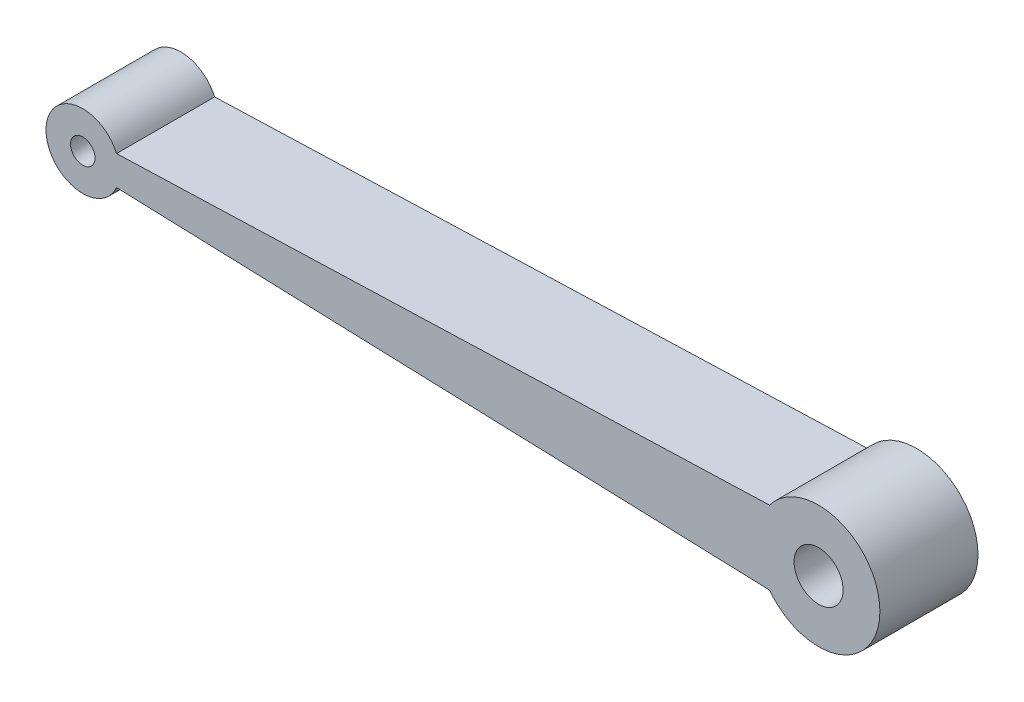
from build123d import *

# Parameters (mm, degrees)
SKETCH3_R           = 2.5
SKETCH3_R_2         = 5
BOSS_EXTRUDE2_DEPTH = 10


with BuildPart() as part:
    # Sketch3 → Boss-Extrude2 (new, symmetric)
    with BuildSketch(Plane.XY):
        with BuildLine():
            Line((6.873863542, 3), (140, 7.5))
            ThreePointArc((140, 7.5), (162.5, 0), (140, -7.5))
            Line((140, -7.5), (6.873863542, -3))
            ThreePointArc((6.873863542, -3), (-7.5, 0), (6.873863542, 3))
        make_face()
        Circle(SKETCH3_R, mode=Mode.SUBTRACT)
        with Locations((150, 0)):
            Circle(SKETCH3_R_2, mode=Mode.SUBTRACT)
    extrude(amount=BOSS_EXTRUDE2_DEPTH, both=True)


solid = part.part
